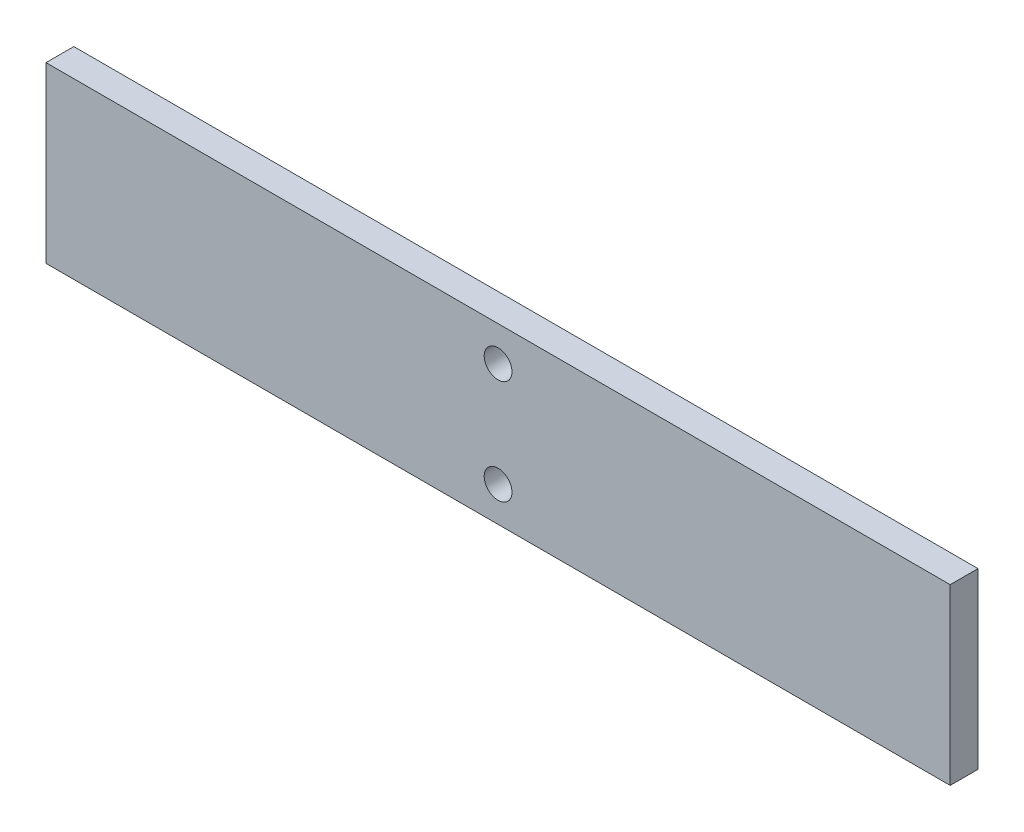
from build123d import *

# Parameters (mm, degrees)
SKETCH_1_W          = 52
SKETCH_1_H          = 10
EXTRUDE_1_DEPTH     = 1.6
SKETCH_2_R          = 0.8
CUT_EXTRUDE_1_DEPTH = 1.6


with BuildPart() as part:
    # 草图1 → 凸台-拉伸1 (new body)
    with BuildSketch(Plane.XY):
        with Locations((26, 5)):
            Rectangle(SKETCH_1_W, SKETCH_1_H)
    extrude(amount=EXTRUDE_1_DEPTH)

    # 草图2 → 切除-拉伸1 (cut)
    with BuildSketch(Plane.XY):
        with Locations((26, 2)):
            Circle(SKETCH_2_R)
        with Locations((26, 8)):
            Circle(SKETCH_2_R)
    extrude(amount=CUT_EXTRUDE_1_DEPTH, mode=Mode.SUBTRACT)


solid = part.part
